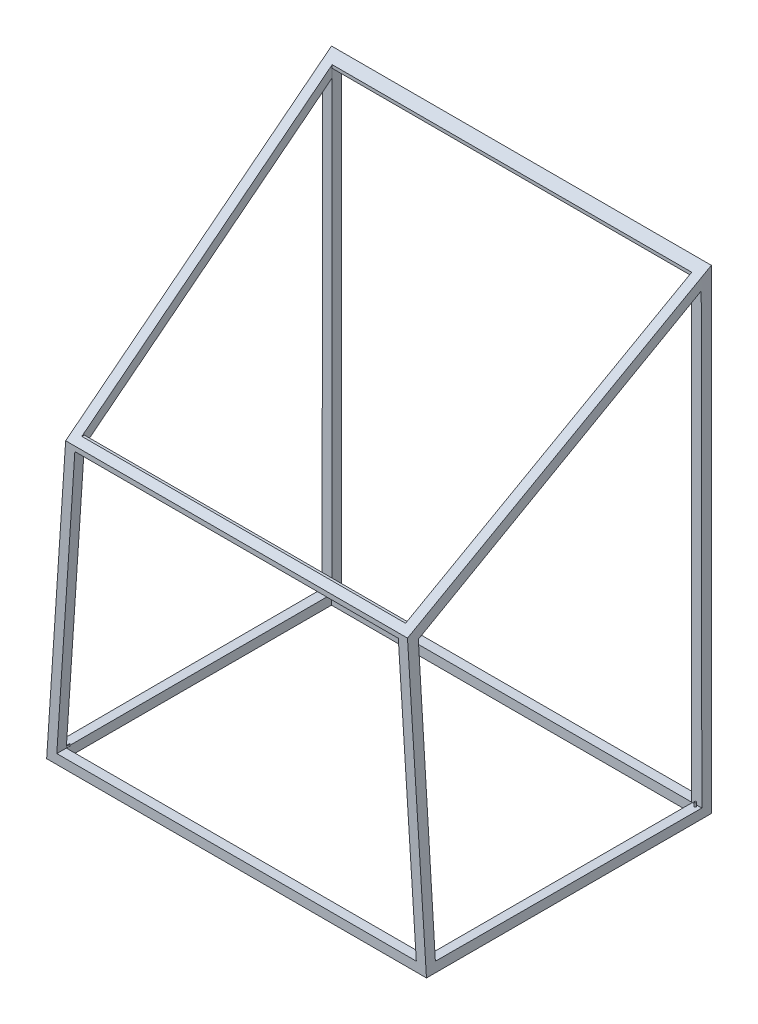
from build123d import *

# Parameters (mm, degrees)
ENL_V_MAT_EXTRU_1_DEPTH      = 1873
ENL_V_MAT_EXTRU_1_DEPTH_BACK = 1210
ENL_V_MAT_EXTRU_2_DEPTH      = 2794
ESQUISSE5_W                  = 1891.306300633
ESQUISSE5_H                  = 2400
ENL_V_MAT_EXTRU_3_DEPTH      = 50
ESQUISSE7_W                  = 1900
ESQUISSE7_H                  = 1400
ENL_V_MAT_EXTRU_5_DEPTH      = 50
ENL_V_MAT_EXTRU_6_DEPTH      = 1354
ENL_V_MAT_EXTRU_6_DEPTH_BACK = 877
ESQUISSE10_R                 = 5
BOSS_EXTRU_1_DEPTH           = 20
BOSS_EXTRU_3_DEPTH           = 20


with BuildPart() as part:
    # Esquisse2 → Lissage1 section 0
    with BuildSketch(Plane.XY.offset(1500)):
        with BuildLine():
            Line((-732.081466601, -1201.10701107), (1267.918533399, -1201.10701107))
            Line((1267.918533399, -1201.10701107), (1167.918533399, 298.89298893))
            Line((1167.918533399, 298.89298893), (-632.081466601, 298.89298893))
            Line((-632.081466601, 298.89298893), (-732.081466601, -1201.10701107))
        make_face()
    # Esquisse1 → Lissage1 section 1
    with BuildSketch(Plane.XY):
        with BuildLine():
            Line((-732.081466601, 1298.89298893), (1267.918533399, 1298.89298893))
            Line((1267.918533399, 1298.89298893), (1267.918533399, -1201.10701107))
            Line((1267.918533399, -1201.10701107), (-732.081466601, -1201.10701107))
            Line((-732.081466601, -1201.10701107), (-732.081466601, 1298.89298893))
        make_face()
    loft()

    # Esquisse3 → Enlèv. mat.-Extru.1 (cut, two sides: drawn at the far end of the back side and taken through both)
    with BuildSketch(Plane(origin=(0, 0, 0), x_dir=(0, 0, -1), z_dir=(1, 0, 0)).offset(-ENL_V_MAT_EXTRU_1_DEPTH_BACK)):
        Polygon((-1450, -1151.10701107), (-50, -1151.10701107), (-50, 1205.467134339), (-1450, 272.133801005), align=None)
    extrude(amount=ENL_V_MAT_EXTRU_1_DEPTH + ENL_V_MAT_EXTRU_1_DEPTH_BACK, mode=Mode.SUBTRACT)

    # Esquisse4 → Enlèv. mat.-Extru.2 (cut)
    with BuildSketch(Plane.XY):
        Polygon((-583.637145339, 273.89298893), (-678.637145339, -1151.10701107), (1214.474212138, -1151.10701107), (1119.474212138, 273.89298893), align=None)
        Polygon((-676.832088495, 1248.89298893), (-584.332088495, 323.89298893), (1120.169155294, 323.89298893), (1212.669155294, 1248.89298893), align=None)
    extrude(amount=ENL_V_MAT_EXTRU_2_DEPTH, mode=Mode.SUBTRACT)

    # Esquisse5 → Enlèv. mat.-Extru.3 (cut)
    with BuildSketch(Plane(origin=(0, 0, 0), x_dir=(-1, 0, 0), z_dir=(0, 0, -1))):
        with Locations((-267.016004978, 48.89298893)):
            Rectangle(ESQUISSE5_W, ESQUISSE5_H)
    extrude(amount=-ENL_V_MAT_EXTRU_3_DEPTH, mode=Mode.SUBTRACT)

    # Esquisse7 → Enlèv. mat.-Extru.5 (cut)
    with BuildSketch(Plane.XZ.offset(1201.10701107)):
        with Locations((267.918533399, 750)):
            Rectangle(ESQUISSE7_W, ESQUISSE7_H)
    extrude(amount=-ENL_V_MAT_EXTRU_5_DEPTH, mode=Mode.SUBTRACT)

    # Esquisse6 → Enlèv. mat.-Extru.6 (cut, two sides: drawn at the far end of the back side and taken through both)
    with BuildSketch(Plane(origin=(0, 323.89298893, 0), x_dir=(1, 0, 0), z_dir=(0, 1, 0)).offset(-ENL_V_MAT_EXTRU_6_DEPTH_BACK)):
        Polygon((-678.637145339, -50), (-585.303812006, -1450), (1121.140878805, -1450), (1214.474212138, -50), align=None)
    extrude(amount=ENL_V_MAT_EXTRU_6_DEPTH + ENL_V_MAT_EXTRU_6_DEPTH_BACK, mode=Mode.SUBTRACT)

    # Esquisse10 → Boss.-Extru.1 (add)
    with BuildSketch(Plane(origin=(0, -1151.10701107, 0), x_dir=(1, 0, 0), z_dir=(0, 1, 0))):
        with Locations(Location((1242.883533399, -60, 0), (0, 0, 270))):
            Circle(ESQUISSE10_R)
    boss_extru_1 = extrude(amount=BOSS_EXTRU_1_DEPTH)

    # Esquisse11 → Boss.-Extru.3 (add)
    with BuildSketch(Plane(origin=(0, 0, 1450), x_dir=(-1, 0, 0), z_dir=(0, 0, -1))):
        with BuildLine():
            Line((-1214.554595697, -1151.10701107), (-1213.872047927, -1142.074547901))
            Line((-1213.872047927, -1142.074547901), (-1217.23598563, -1142.074547901))
            Line((-1217.23598563, -1142.074547901), (-1217.918533399, -1151.10701107))
            Line((-1217.918533399, -1151.10701107), (-1217.918533399, -1153.99826826))
            ThreePointArc((-1217.918533399, -1153.99826826), (-1215.637765578, -1153.249333975), (-1214.554595697, -1151.10701107))
        make_face()
    boss_extru_3 = extrude(amount=BOSS_EXTRU_3_DEPTH)

    # Symétrie1: Boss.-Extru.1, Boss.-Extru.3 across plane
    add(boss_extru_1.mirror(Plane(origin=(267.918533399, 0, 0), x_dir=(0, 0, 1), z_dir=(1, 0, 0))))
    add(boss_extru_3.mirror(Plane(origin=(267.918533399, 0, 0), x_dir=(0, 0, 1), z_dir=(1, 0, 0))))


solid = part.part
